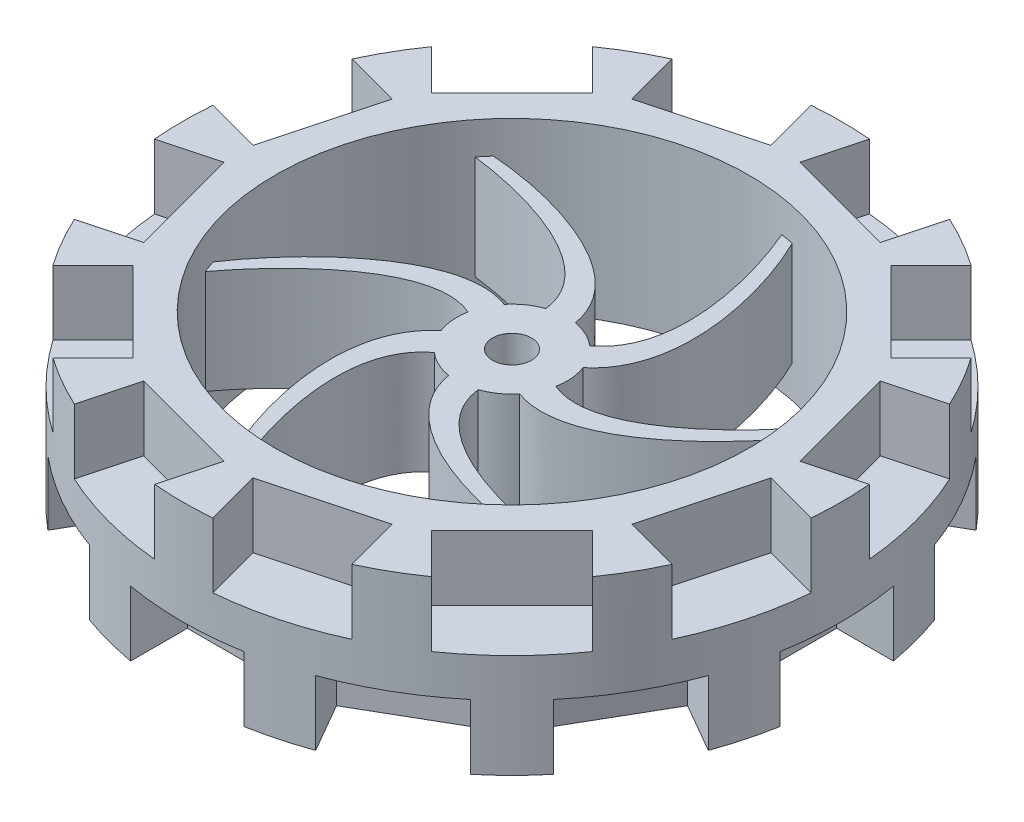
from build123d import *
from build123d.topology import SkipClean

# Parameters (mm, degrees)
SKETCH1_R           = 50.8
BOSS_EXTRUDE1_DEPTH = 13
SKETCH2_R           = 3
CUT_EXTRUDE1_DEPTH  = 77.402094212
CUT_EXTRUDE2_START  = -10
CUT_EXTRUDE2_DEPTH  = 10
CUT_EXTRUDE3_DEPTH  = 10
CIRPATTERN1_COUNT   = 12
SKETCH8_R           = 36.5
CUT_EXTRUDE4_DEPTH  = 5
CUT_EXTRUDE5_DEPTH  = 75.848380076


with BuildPart() as part:
    # Sketch1 → Boss-Extrude1 (new, symmetric)
    with BuildSketch(Plane(origin=(0, 0, 0), x_dir=(1, 0, 0), z_dir=(0, 1, 0))):
        with Locations(Location((0, 0, 0), (0, 0, 90))):
            Circle(SKETCH1_R)
    extrude(amount=BOSS_EXTRUDE1_DEPTH, both=True)

    # Sketch2 → Cut-Extrude1 (cut, through all)
    with BuildSketch(Plane.XZ.offset(13)):
        with Locations(Location((0, 0, 0), (0, 0, 270))):
            Circle(SKETCH2_R)
    extrude(amount=-CUT_EXTRUDE1_DEPTH, mode=Mode.SUBTRACT)

    # Sketch4 → Cut-Extrude2 (cut)
    with BuildSketch(Plane.XZ.offset(13).offset(CUT_EXTRUDE2_START)):
        with BuildLine():
            Line((-8.75, 53.3), (-8.75, 50.040758388))
            ThreePointArc((-8.75, 50.040758388), (0, 50.8), (8.75, 50.040758388))
            Line((8.75, 50.040758388), (8.75, 53.3))
            Line((8.75, 53.3), (-8.75, 53.3))
        make_face()
        with BuildLine():
            Line((-8.75, 41.3), (0, 41.3))
            Line((0, 41.3), (0, 49.3))
            ThreePointArc((0, 49.3), (-4.392468947, 49.103932801), (-8.75, 48.517290732))
            Line((-8.75, 48.517290732), (-8.75, 41.3))
        make_face()
        with BuildLine():
            ThreePointArc((-8.75, 48.517290732), (-4.392468947, 49.103932801), (0, 49.3))
            Line((0, 49.3), (-8.75, 49.3))
            Line((-8.75, 49.3), (-8.75, 48.517290732))
        make_face()
        with BuildLine():
            Line((0, 49.3), (0, 41.3))
            Line((0, 41.3), (8.75, 41.3))
            Line((8.75, 41.3), (8.75, 48.517290732))
            ThreePointArc((8.75, 48.517290732), (4.392468947, 49.103932801), (0, 49.3))
        make_face()
        with BuildLine():
            Line((8.75, 49.3), (0, 49.3))
            ThreePointArc((0, 49.3), (4.392468947, 49.103932801), (8.75, 48.517290732))
            Line((8.75, 48.517290732), (8.75, 49.3))
        make_face()
        with BuildLine():
            Line((-8.75, 49.3), (0, 49.3))
            Line((0, 49.3), (8.75, 49.3))
            Line((8.75, 49.3), (8.75, 50.040758388))
            ThreePointArc((8.75, 50.040758388), (0, 50.8), (-8.75, 50.040758388))
            Line((-8.75, 50.040758388), (-8.75, 49.3))
        make_face()
    cut_extrude2 = extrude(amount=CUT_EXTRUDE2_DEPTH, mode=Mode.SUBTRACT)

    # Sketch6 → Cut-Extrude3 (cut)
    with BuildSketch(Plane(origin=(0, 13, 0), x_dir=(1, 0, 0), z_dir=(0, 1, 0))):
        Polygon((-4.696156511, -51.33369862), (-21.599858471, -46.804365331), (-19.141077543, -37.628069981), (-2.237375583, -42.15740327), align=None)
    cut_extrude3 = extrude(amount=-CUT_EXTRUDE3_DEPTH, mode=Mode.SUBTRACT)

    # CirPattern1: Cut-Extrude2, Cut-Extrude3 ×12 about axis
    cirpattern1_axis = Axis((0, 0, 0), (0, 1, 0))
    add([cut_extrude2.rotate(cirpattern1_axis, i * 360 / CIRPATTERN1_COUNT) for i in range(1, CIRPATTERN1_COUNT)], mode=Mode.SUBTRACT)
    add([cut_extrude3.rotate(cirpattern1_axis, i * 360 / CIRPATTERN1_COUNT) for i in range(1, CIRPATTERN1_COUNT)], mode=Mode.SUBTRACT)

    # Sketch8 → Cut-Extrude4 (cut)
    with BuildSketch(Plane(origin=(0, 13, 0), x_dir=(1, 0, 0), z_dir=(0, 1, 0))):
        with Locations(Location((0, 0, 0), (0, 0, 270))):
            Circle(SKETCH8_R)
    cut_extrude4 = extrude(amount=-CUT_EXTRUDE4_DEPTH, mode=Mode.SUBTRACT)

    # Mirror1: Cut-Extrude4 across plane
    add(cut_extrude4.mirror(Plane.ZX), mode=Mode.SUBTRACT)

    # Sketch11 → Cut-Extrude5 (cut, through all)
    with SkipClean():  # the faces are left unmerged after this step: merging them gives an invalid solid
        with BuildSketch(Plane.XZ.offset(8)):
            with BuildLine():
                ThreePointArc((-24.148401826, 2.994294631), (-20.283207871, 13.442566332), (-12.166666667, 21.073284825))
                add(Edge.make_bspline(
                    [(-12.166666667, 21.073284825), (-11.274104098, 26.611025754), (-9.302647196, 32.051547875), (-7.470537962, 35.727315356)],
                    knots=[0.639057003, 0.639057003, 0.639057003, 0.639057003, 1, 1, 1, 1], degree=3))
                ThreePointArc((-7.470537962, 35.727315356), (-23.578843206, 27.86194812), (-33.99988192, 13.276220448))
                add(Edge.make_bspline(
                    [(-33.99988192, 13.276220448), (-31.845510347, 10.374006002), (-28.262694265, 6.267657786), (-24.148401826, 2.994294631)],
                    knots=[0, 0, 0, 0, 0.364010383, 0.364010383, 0.364010383, 0.364010383], degree=3))
            make_face()
            with BuildLine():
                ThreePointArc((-11.939994041, -2.33758852), (-12.001157352, 2), (-10.536642413, 6.083333333))
                add(Edge.make_bspline(
                    [(-10.536642413, 6.083333333), (-12.879962872, 10.127438053), (-13.041259589, 15.647033274), (-12.166666667, 21.073284825)],
                    knots=[0.285380744, 0.285380744, 0.285380744, 0.285380744, 0.639057003, 0.639057003, 0.639057003, 0.639057003], degree=3))
                ThreePointArc((-12.166666667, 21.073284825), (-20.283207871, 13.442566332), (-24.148401826, 2.994294631))
                add(Edge.make_bspline(
                    [(-24.148401826, 2.994294631), (-20.299283301, -0.068094091), (-15.984989949, -2.401412412), (-11.939994041, -2.33758852)],
                    knots=[0.364010383, 0.364010383, 0.364010383, 0.364010383, 0.70455961, 0.70455961, 0.70455961, 0.70455961], degree=3))
            make_face()
            with BuildLine():
                add(Edge.make_bspline(
                    [(-7.952055394, 3.002468154), (-9.011469688, 3.883093885), (-9.863961222, 4.922419483), (-10.536642413, 6.083333333)],
                    knots=[0.183853287, 0.183853287, 0.183853287, 0.183853287, 0.285380744, 0.285380744, 0.285380744, 0.285380744], degree=3))
                ThreePointArc((-10.536642413, 6.083333333), (-12.001157352, 2), (-11.939994041, -2.33758852))
                add(Edge.make_bspline(
                    [(-11.939994041, -2.33758852), (-10.712890606, -2.318226691), (-9.510570429, -2.078257516), (-8.35353874, -1.571111235)],
                    knots=[0.70455961, 0.70455961, 0.70455961, 0.70455961, 0.807869758, 0.807869758, 0.807869758, 0.807869758], degree=3))
                ThreePointArc((-8.35353874, -1.571111235), (-8.46743805, 0.743298646), (-7.952055394, 3.002468154))
            make_face()
            with BuildLine():
                add(Edge.make_bspline(
                    [(-1.375814001, 8.38791606), (-1.142876894, 9.745708618), (-0.669040291, 11.003650742), (0, 12.166666667)],
                    knots=[0.183853287, 0.183853287, 0.183853287, 0.183853287, 0.285380744, 0.285380744, 0.285380744, 0.285380744], degree=3))
                ThreePointArc((0, 12.166666667), (-4.268527868, 11.393307141), (-7.994408062, 9.1715439))
                add(Edge.make_bspline(
                    [(-7.994408062, 9.1715439), (-7.364088509, 8.118522067), (-6.555109019, 7.197266838), (-5.537391612, 6.448821143)],
                    knots=[0.70455961, 0.70455961, 0.70455961, 0.70455961, 0.807869758, 0.807869758, 0.807869758, 0.807869758], degree=3))
                ThreePointArc((-5.537391612, 6.448821143), (-3.590003515, 7.704665779), (-1.375814001, 8.38791606))
            make_face()
            with BuildLine():
                ThreePointArc((-7.994408062, 9.1715439), (-4.268527868, 11.393307141), (0, 12.166666667))
                add(Edge.make_bspline(
                    [(0, 12.166666667), (2.330637193, 16.218094073), (7.030098515, 19.117578739), (12.166666667, 21.073284825)],
                    knots=[0.285380744, 0.285380744, 0.285380744, 0.285380744, 0.639057003, 0.639057003, 0.639057003, 0.639057003], degree=3))
                ThreePointArc((12.166666667, 21.073284825), (1.5, 24.287056452), (-9.481065696, 22.410276758))
                add(Edge.make_bspline(
                    [(-9.481065696, 22.410276758), (-10.208612863, 17.545647972), (-10.072179129, 12.642701169), (-7.994408062, 9.1715439)],
                    knots=[0.364010383, 0.364010383, 0.364010383, 0.364010383, 0.70455961, 0.70455961, 0.70455961, 0.70455961], degree=3))
            make_face()
            with BuildLine():
                ThreePointArc((-9.481065696, 22.410276758), (1.5, 24.287056452), (12.166666667, 21.073284825))
                add(Edge.make_bspline(
                    [(12.166666667, 21.073284825), (17.408772275, 23.069173431), (23.106131092, 24.082102731), (27.205493726, 24.333333333)],
                    knots=[0.639057003, 0.639057003, 0.639057003, 0.639057003, 1, 1, 1, 1], degree=3))
                ThreePointArc((27.205493726, 24.333333333), (12.339733268, 34.350851269), (-5.502396786, 36.082871693))
                add(Edge.make_bspline(
                    [(-5.502396786, 36.082871693), (-6.938602436, 32.766023958), (-8.703396267, 27.610040106), (-9.481065696, 22.410276758)],
                    knots=[0, 0, 0, 0, 0.364010383, 0.364010383, 0.364010383, 0.364010383], degree=3))
            make_face()
            with BuildLine():
                ThreePointArc((3.945585979, 11.50913242), (7.732629483, 9.393307141), (10.536642413, 6.083333333))
                add(Edge.make_bspline(
                    [(10.536642413, 6.083333333), (15.210600065, 6.09065602), (20.071358104, 3.470545464), (24.333333333, 0)],
                    knots=[0.285380744, 0.285380744, 0.285380744, 0.285380744, 0.639057003, 0.639057003, 0.639057003, 0.639057003], degree=3))
                ThreePointArc((24.333333333, 0), (21.783207871, 10.84449012), (14.66733613, 19.415982127))
                add(Edge.make_bspline(
                    [(14.66733613, 19.415982127), (10.090670438, 17.613742062), (5.91281082, 15.044113581), (3.945585979, 11.50913242)],
                    knots=[0.364010383, 0.364010383, 0.364010383, 0.364010383, 0.70455961, 0.70455961, 0.70455961, 0.70455961], degree=3))
            make_face()
            with BuildLine():
                add(Edge.make_bspline(
                    [(6.576241392, 5.385447906), (7.868592794, 5.862614733), (9.194920931, 6.081231259), (10.536642413, 6.083333333)],
                    knots=[0.183853287, 0.183853287, 0.183853287, 0.183853287, 0.285380744, 0.285380744, 0.285380744, 0.285380744], degree=3))
                ThreePointArc((10.536642413, 6.083333333), (7.732629483, 9.393307141), (3.945585979, 11.50913242))
                add(Edge.make_bspline(
                    [(3.945585979, 11.50913242), (3.348802097, 10.436748758), (2.95546141, 9.275524354), (2.816147129, 8.019932378)],
                    knots=[0.70455961, 0.70455961, 0.70455961, 0.70455961, 0.807869758, 0.807869758, 0.807869758, 0.807869758], degree=3))
                ThreePointArc((2.816147129, 8.019932378), (4.877434535, 6.961367133), (6.576241392, 5.385447906))
            make_face()
            with BuildLine():
                ThreePointArc((14.66733613, 19.415982127), (21.783207871, 10.84449012), (24.333333333, 0))
                add(Edge.make_bspline(
                    [(24.333333333, 0), (28.682876373, -3.541852323), (32.408778288, -7.969445143), (34.676031689, -11.393982023)],
                    knots=[0.639057003, 0.639057003, 0.639057003, 0.639057003, 1, 1, 1, 1], degree=3))
                ThreePointArc((34.676031689, -11.393982023), (36.041123433, -5.769525256), (36.5, 0))
                ThreePointArc((36.5, 0), (34.441313908, 12.084945026), (28.497485135, 22.806651245))
                add(Edge.make_bspline(
                    [(28.497485135, 22.806651245), (24.90690791, 22.392017956), (19.559297998, 21.34238232), (14.66733613, 19.415982127)],
                    knots=[0, 0, 0, 0, 0.364010383, 0.364010383, 0.364010383, 0.364010383], degree=3))
            make_face()
            with BuildLine():
                ThreePointArc((11.939994041, 2.33758852), (12.109865921, 1.174276433), (12.166666667, 0))
                ThreePointArc((12.166666667, 0), (11.752097553, -3.148965049), (10.536642413, -6.083333333))
                add(Edge.make_bspline(
                    [(10.536642413, -6.083333333), (12.879962872, -10.127438053), (13.041259589, -15.647033274), (12.166666667, -21.073284825)],
                    knots=[0.285380744, 0.285380744, 0.285380744, 0.285380744, 0.639057003, 0.639057003, 0.639057003, 0.639057003], degree=3))
                ThreePointArc((12.166666667, -21.073284825), (20.283207871, -13.442566332), (24.148401826, -2.994294631))
                add(Edge.make_bspline(
                    [(24.148401826, -2.994294631), (20.299283301, 0.068094091), (15.984989949, 2.401412412), (11.939994041, 2.33758852)],
                    knots=[0.364010383, 0.364010383, 0.364010383, 0.364010383, 0.70455961, 0.70455961, 0.70455961, 0.70455961], degree=3))
            make_face()
            with BuildLine():
                ThreePointArc((10.536642413, -6.083333333), (11.752097553, -3.148965049), (12.166666667, 0))
                ThreePointArc((12.166666667, 0), (12.109865921, 1.174276433), (11.939994041, 2.33758852))
                add(Edge.make_bspline(
                    [(11.939994041, 2.33758852), (10.712890606, 2.318226691), (9.510570429, 2.078257516), (8.35353874, 1.571111235)],
                    knots=[0.70455961, 0.70455961, 0.70455961, 0.70455961, 0.807869758, 0.807869758, 0.807869758, 0.807869758], degree=3))
                ThreePointArc((8.35353874, 1.571111235), (8.46330548, 0.788961566), (8.5, 0))
                ThreePointArc((8.5, 0), (8.361891857, -1.526029022), (7.952055394, -3.002468154))
                add(Edge.make_bspline(
                    [(7.952055394, -3.002468154), (9.011469688, -3.883093885), (9.863961222, -4.922419483), (10.536642413, -6.083333333)],
                    knots=[0.183853287, 0.183853287, 0.183853287, 0.183853287, 0.285380744, 0.285380744, 0.285380744, 0.285380744], degree=3))
            make_face()
            with BuildLine():
                add(Edge.make_bspline(
                    [(33.99988192, -13.276220448), (31.845510347, -10.374006002), (28.262694265, -6.267657786), (24.148401826, -2.994294631)],
                    knots=[0, 0, 0, 0, 0.364010383, 0.364010383, 0.364010383, 0.364010383], degree=3))
                ThreePointArc((24.148401826, -2.994294631), (20.283207871, -13.442566332), (12.166666667, -21.073284825))
                add(Edge.make_bspline(
                    [(12.166666667, -21.073284825), (11.274104098, -26.611025754), (9.302647196, -32.051547875), (7.470537962, -35.727315356)],
                    knots=[0.639057003, 0.639057003, 0.639057003, 0.639057003, 1, 1, 1, 1], degree=3))
                ThreePointArc((7.470537962, -35.727315356), (23.578843206, -27.86194812), (33.99988192, -13.276220448))
            make_face()
            with BuildLine():
                add(Edge.make_bspline(
                    [(5.502396786, -36.082871693), (6.938602436, -32.766023958), (8.703396267, -27.610040106), (9.481065696, -22.410276758)],
                    knots=[0, 0, 0, 0, 0.364010383, 0.364010383, 0.364010383, 0.364010383], degree=3))
                ThreePointArc((9.481065696, -22.410276758), (-1.5, -24.287056452), (-12.166666667, -21.073284825))
                add(Edge.make_bspline(
                    [(-12.166666667, -21.073284825), (-17.408772275, -23.069173431), (-23.106131092, -24.082102731), (-27.205493726, -24.333333333)],
                    knots=[0.639057003, 0.639057003, 0.639057003, 0.639057003, 1, 1, 1, 1], degree=3))
                ThreePointArc((-27.205493726, -24.333333333), (-12.339733268, -34.350851269), (5.502396786, -36.082871693))
            make_face()
            with BuildLine():
                add(Edge.make_bspline(
                    [(9.481065696, -22.410276758), (10.208612863, -17.545647972), (10.072179129, -12.642701169), (7.994408062, -9.1715439)],
                    knots=[0.364010383, 0.364010383, 0.364010383, 0.364010383, 0.70455961, 0.70455961, 0.70455961, 0.70455961], degree=3))
                ThreePointArc((7.994408062, -9.1715439), (4.268527868, -11.393307141), (0, -12.166666667))
                add(Edge.make_bspline(
                    [(0, -12.166666667), (-2.330637193, -16.218094073), (-7.030098515, -19.117578739), (-12.166666667, -21.073284825)],
                    knots=[0.285380744, 0.285380744, 0.285380744, 0.285380744, 0.639057003, 0.639057003, 0.639057003, 0.639057003], degree=3))
                ThreePointArc((-12.166666667, -21.073284825), (-1.5, -24.287056452), (9.481065696, -22.410276758))
            make_face()
            with BuildLine():
                ThreePointArc((0, -12.166666667), (4.268527868, -11.393307141), (7.994408062, -9.1715439))
                add(Edge.make_bspline(
                    [(7.994408062, -9.1715439), (7.364088509, -8.118522067), (6.555109019, -7.197266838), (5.537391612, -6.448821143)],
                    knots=[0.70455961, 0.70455961, 0.70455961, 0.70455961, 0.807869758, 0.807869758, 0.807869758, 0.807869758], degree=3))
                ThreePointArc((5.537391612, -6.448821143), (3.590003515, -7.704665779), (1.375814001, -8.38791606))
                add(Edge.make_bspline(
                    [(1.375814001, -8.38791606), (1.142876894, -9.745708618), (0.669040291, -11.003650742), (0, -12.166666667)],
                    knots=[0.183853287, 0.183853287, 0.183853287, 0.183853287, 0.285380744, 0.285380744, 0.285380744, 0.285380744], degree=3))
            make_face()
            with BuildLine():
                add(Edge.make_bspline(
                    [(-14.66733613, -19.415982127), (-10.090670438, -17.613742062), (-5.91281082, -15.044113581), (-3.945585979, -11.50913242)],
                    knots=[0.364010383, 0.364010383, 0.364010383, 0.364010383, 0.70455961, 0.70455961, 0.70455961, 0.70455961], degree=3))
                ThreePointArc((-3.945585979, -11.50913242), (-7.732629483, -9.393307141), (-10.536642413, -6.083333333))
                add(Edge.make_bspline(
                    [(-10.536642413, -6.083333333), (-15.210600065, -6.09065602), (-20.071358104, -3.470545464), (-24.333333333, 0)],
                    knots=[0.285380744, 0.285380744, 0.285380744, 0.285380744, 0.639057003, 0.639057003, 0.639057003, 0.639057003], degree=3))
                ThreePointArc((-24.333333333, 0), (-21.783207871, -10.84449012), (-14.66733613, -19.415982127))
            make_face()
            with BuildLine():
                ThreePointArc((-10.536642413, -6.083333333), (-7.732629483, -9.393307141), (-3.945585979, -11.50913242))
                add(Edge.make_bspline(
                    [(-3.945585979, -11.50913242), (-3.348802097, -10.436748758), (-2.95546141, -9.275524354), (-2.816147129, -8.019932378)],
                    knots=[0.70455961, 0.70455961, 0.70455961, 0.70455961, 0.807869758, 0.807869758, 0.807869758, 0.807869758], degree=3))
                ThreePointArc((-2.816147129, -8.019932378), (-4.877434535, -6.961367133), (-6.576241392, -5.385447906))
                add(Edge.make_bspline(
                    [(-6.576241392, -5.385447906), (-7.868592794, -5.862614733), (-9.194920931, -6.081231259), (-10.536642413, -6.083333333)],
                    knots=[0.183853287, 0.183853287, 0.183853287, 0.183853287, 0.285380744, 0.285380744, 0.285380744, 0.285380744], degree=3))
            make_face()
            with BuildLine():
                add(Edge.make_bspline(
                    [(-28.497485135, -22.806651245), (-24.90690791, -22.392017956), (-19.559297998, -21.34238232), (-14.66733613, -19.415982127)],
                    knots=[0, 0, 0, 0, 0.364010383, 0.364010383, 0.364010383, 0.364010383], degree=3))
                ThreePointArc((-14.66733613, -19.415982127), (-21.783207871, -10.84449012), (-24.333333333, 0))
                add(Edge.make_bspline(
                    [(-24.333333333, 0), (-28.682876373, 3.541852323), (-32.408778288, 7.969445143), (-34.676031689, 11.393982023)],
                    knots=[0.639057003, 0.639057003, 0.639057003, 0.639057003, 1, 1, 1, 1], degree=3))
                ThreePointArc((-34.676031689, 11.393982023), (-35.918576474, -6.488903149), (-28.497485135, -22.806651245))
            make_face()
        extrude(amount=-CUT_EXTRUDE5_DEPTH, mode=Mode.SUBTRACT)


solid = part.part
